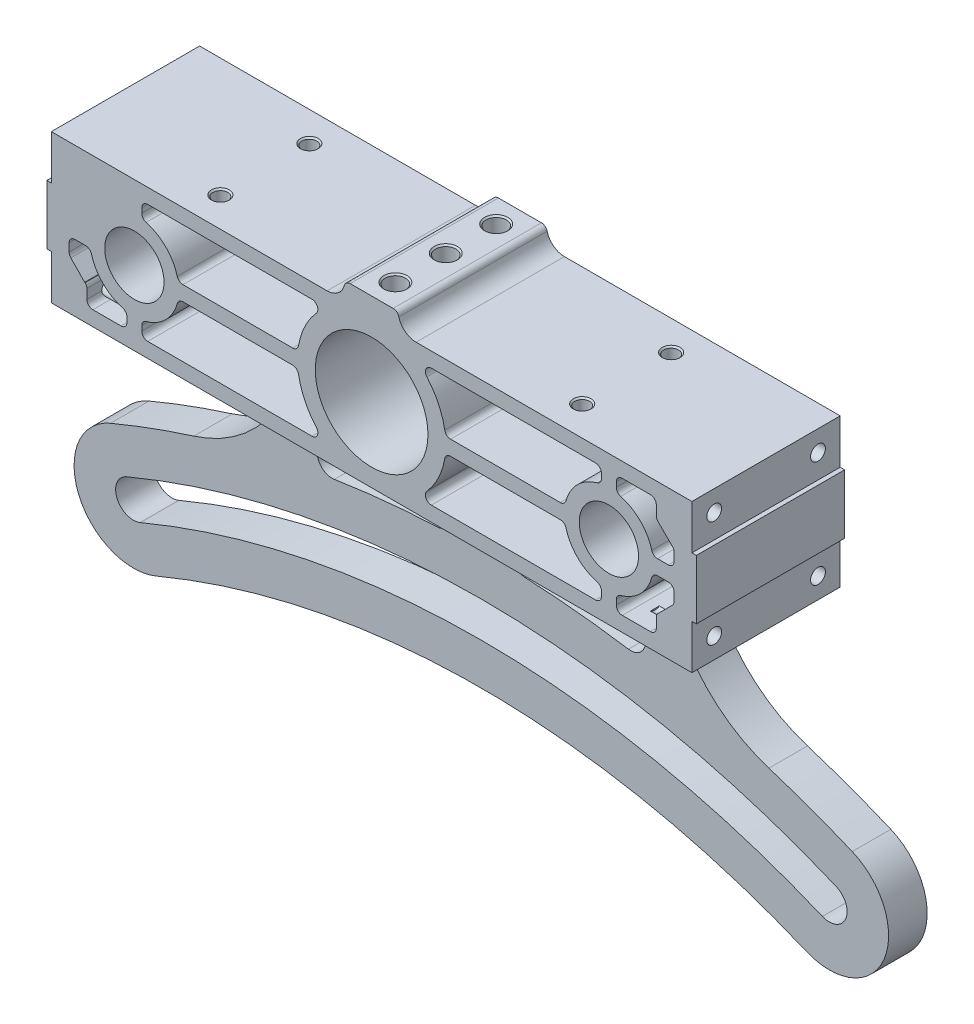
from build123d import *

# Parameters (mm, degrees)
SKETCH_1_R               = 5
SKETCH_1_R_2             = 10
SKETCH_1_R_3             = 19
EXTRUDE_1_DEPTH          = 50
CUT_EXTRUDE_2_DEPTH      = 500
SKETCH_3_R               = 2.5
CUT_EXTRUDE_3_DEPTH      = 20
SKETCH_4_R               = 2.5
CUT_EXTRUDE_4_DEPTH      = 20
CHAMFER_1_SIZE           = 0.5
CUT_EXTRUDE_5_REACH      = 1135.72
CUT_EXTRUDE_5_END_RADIUS = 19
SKETCH_5_R               = 3.425
CHAMFER_2_SIZE           = 0.5


with BuildPart() as part:
    # 草图1 → 拉伸1 (new body)
    with BuildSketch(Plane.XY):
        with BuildLine():
            Line((1092.414463445, 1251.175356322), (1093.914463445, 1251.175356322))
            Line((1093.914463445, 1251.175356322), (1093.914463445, 1271.175356322))
            Line((1093.914463445, 1271.175356322), (1092.414463445, 1271.175356322))
            Line((1092.414463445, 1271.175356322), (1092.414463445, 1286.175356322))
            Line((1092.414463445, 1286.175356322), (999.414463445, 1286.175356322))
            ThreePointArc((999.414463445, 1286.175356322), (995.74022883, 1287.431939832), (993.604988425, 1290.675356322))
            ThreePointArc((993.604988425, 1290.675356322), (992.893241624, 1291.756495152), (991.668496752, 1292.175356322))
            Line((991.668496752, 1292.175356322), (977.160430137, 1292.175356322))
            ThreePointArc((977.160430137, 1292.175356322), (975.935685266, 1291.756495152), (975.223938464, 1290.675356322))
            ThreePointArc((975.223938464, 1290.675356322), (973.088698059, 1287.431939832), (969.414463445, 1286.175356322))
            Line((969.414463445, 1286.175356322), (876.414463445, 1286.175356322))
            Line((876.414463445, 1286.175356322), (876.414463445, 1271.175356322))
            Line((876.414463445, 1271.175356322), (874.914463445, 1271.175356322))
            Line((874.914463445, 1271.175356322), (874.914463445, 1251.175356322))
            Line((874.914463445, 1251.175356322), (876.414463445, 1251.175356322))
            Line((876.414463445, 1251.175356322), (876.414463445, 1236.175356322))
            Line((876.414463445, 1236.175356322), (916.18140927, 1236.175356322))
            ThreePointArc((916.18140927, 1236.175356322), (924.94928431, 1230.98413655), (924.613966096, 1220.800229777))
            Line((924.613966096, 1220.800229777), (914.603278077, 1205.095353829))
            ThreePointArc((914.603278077, 1205.095353829), (902.862999443, 1192.291380213), (887.450409428, 1184.277145889))
            ThreePointArc((887.450409428, 1184.277145889), (873.281582738, 1179.454480881), (859.351378992, 1173.980618339))
            ThreePointArc((859.351378992, 1173.980618339), (848.655242851, 1147.796793721), (874.839067469, 1137.100657579))
            ThreePointArc((874.839067469, 1137.100657579), (984.414463445, 1159.174935205), (1093.98985942, 1137.100657579))
            ThreePointArc((1093.98985942, 1137.100657579), (1120.173684039, 1147.796793721), (1109.477547897, 1173.980618339))
            ThreePointArc((1109.477547897, 1173.980618339), (1095.547344151, 1179.454480881), (1081.378517461, 1184.277145889))
            ThreePointArc((1081.378517461, 1184.277145889), (1065.965927446, 1192.291380213), (1054.225648812, 1205.095353829))
            Line((1054.225648812, 1205.095353829), (1044.214960793, 1220.800229777))
            ThreePointArc((1044.214960793, 1220.800229777), (1043.879642579, 1230.98413655), (1052.64751762, 1236.175356322))
            Line((1052.64751762, 1236.175356322), (1092.414463445, 1236.175356322))
            Line((1092.414463445, 1236.175356322), (1092.414463445, 1251.175356322))
        make_face()
        with Locations((984.414463445, 1216.175356322)):
            Circle(SKETCH_1_R, mode=Mode.SUBTRACT)
        with Locations((904.414463445, 1261.175356322)):
            Circle(SKETCH_1_R_2, mode=Mode.SUBTRACT)
        with Locations((1064.414463445, 1261.175356322)):
            Circle(SKETCH_1_R_2, mode=Mode.SUBTRACT)
        with Locations((984.414463445, 1261.175356322)):
            Circle(SKETCH_1_R_3, mode=Mode.SUBTRACT)
        with BuildLine():
            Line((974.414463445, 1221.175356322), (974.414463445, 1203.831767882))
            ThreePointArc((974.414463445, 1203.831767882), (973.029936628, 1200.378023007), (969.643121981, 1198.836999091))
            ThreePointArc((969.643121981, 1198.836999091), (952.193462787, 1197.563807315), (934.838343201, 1195.347628745))
            ThreePointArc((934.838343201, 1195.347628745), (929.885049048, 1197.553686969), (929.854632586, 1202.975945787))
            Line((929.854632586, 1202.975945787), (943.168521797, 1223.862919594))
            ThreePointArc((943.168521797, 1223.862919594), (944.980410096, 1225.559293842), (947.38480021, 1226.175356322))
            Line((947.38480021, 1226.175356322), (969.414463445, 1226.175356322))
            ThreePointArc((969.414463445, 1226.175356322), (972.949997351, 1224.710890228), (974.414463445, 1221.175356322))
        make_face(mode=Mode.SUBTRACT)
        with BuildLine():
            Line((994.414463445, 1221.175356322), (994.414463445, 1203.831767882))
            ThreePointArc((994.414463445, 1203.831767882), (995.798990261, 1200.378023007), (999.185804908, 1198.836999091))
            ThreePointArc((999.185804908, 1198.836999091), (1016.635464102, 1197.563807315), (1033.990583688, 1195.347628745))
            ThreePointArc((1033.990583688, 1195.347628745), (1038.943877841, 1197.553686969), (1038.974294303, 1202.975945787))
            Line((1038.974294303, 1202.975945787), (1025.660405092, 1223.862919594))
            ThreePointArc((1025.660405092, 1223.862919594), (1023.848516793, 1225.559293842), (1021.444126679, 1226.175356322))
            Line((1021.444126679, 1226.175356322), (999.414463445, 1226.175356322))
            ThreePointArc((999.414463445, 1226.175356322), (995.878929539, 1224.710890228), (994.414463445, 1221.175356322))
        make_face(mode=Mode.SUBTRACT)
        with BuildLine():
            Line((883.000249882, 1252.589569884), (887.661517332, 1247.795218361))
            Line((887.661517332, 1247.795218361), (887.828677007, 1247.76114276))
            ThreePointArc((887.828677007, 1247.76114276), (888.26222251, 1247.112296062), (888.414463445, 1246.346929197))
            Line((888.414463445, 1246.346929197), (888.414463445, 1243.175356322))
            ThreePointArc((888.414463445, 1243.175356322), (889.000249882, 1241.76114276), (890.414463445, 1241.175356322))
            Line((890.414463445, 1241.175356322), (899.914463445, 1241.175356322))
            ThreePointArc((899.914463445, 1241.175356322), (901.328677007, 1241.76114276), (901.914463445, 1243.175356322))
            Line((901.914463445, 1243.175356322), (901.914463445, 1244.781760011))
            ThreePointArc((901.914463445, 1244.781760011), (901.504875896, 1245.994438136), (900.44387521, 1246.710418401))
            ThreePointArc((900.44387521, 1246.710418401), (893.807861727, 1250.568754604), (889.949525523, 1257.204768087))
            ThreePointArc((889.949525523, 1257.204768087), (889.233545259, 1258.265768773), (888.020867134, 1258.675356322))
            Line((888.020867134, 1258.675356322), (884.414463445, 1258.675356322))
            ThreePointArc((884.414463445, 1258.675356322), (883.000249882, 1258.089569884), (882.414463445, 1256.675356322))
            Line((882.414463445, 1256.675356322), (882.414463445, 1254.003783447))
            ThreePointArc((882.414463445, 1254.003783447), (882.56670438, 1253.238416582), (883.000249882, 1252.589569884))
        make_face(mode=Mode.SUBTRACT)
        with BuildLine():
            Line((920.808059756, 1258.675356322), (957.792104421, 1258.675356322))
            ThreePointArc((957.792104421, 1258.675356322), (959.08309887, 1258.202881554), (959.764131015, 1257.008689656))
            ThreePointArc((959.764131015, 1257.008689656), (961.887952614, 1250.333017562), (965.780563632, 1244.508689656))
            ThreePointArc((965.780563632, 1244.508689656), (966.115593506, 1242.358859741), (964.289851647, 1241.175356322))
            Line((964.289851647, 1241.175356322), (908.914463445, 1241.175356322))
            ThreePointArc((908.914463445, 1241.175356322), (907.500249883, 1241.76114276), (906.914463445, 1243.175356322))
            Line((906.914463445, 1243.175356322), (906.914463445, 1244.781760012))
            ThreePointArc((906.914463445, 1244.781760012), (907.324050994, 1245.994438137), (908.38505168, 1246.710418401))
            ThreePointArc((908.38505168, 1246.710418401), (915.021065163, 1250.568754605), (918.879401366, 1257.204768087))
            ThreePointArc((918.879401366, 1257.204768087), (919.595381631, 1258.265768774), (920.808059756, 1258.675356322))
        make_face(mode=Mode.SUBTRACT)
        with BuildLine():
            Line((920.808059756, 1263.675356322), (957.792104421, 1263.675356322))
            ThreePointArc((957.792104421, 1263.675356322), (959.08309887, 1264.147831091), (959.764131015, 1265.342022989))
            ThreePointArc((959.764131015, 1265.342022989), (961.887952614, 1272.017695083), (965.780563632, 1277.842022989))
            ThreePointArc((965.780563632, 1277.842022989), (966.115593506, 1279.991852903), (964.289851647, 1281.175356322))
            Line((964.289851647, 1281.175356322), (908.914463445, 1281.175356322))
            ThreePointArc((908.914463445, 1281.175356322), (907.500249883, 1280.589569885), (906.914463445, 1279.175356322))
            Line((906.914463445, 1279.175356322), (906.914463445, 1277.568952633))
            ThreePointArc((906.914463445, 1277.568952633), (907.324050994, 1276.356274508), (908.38505168, 1275.640294244))
            ThreePointArc((908.38505168, 1275.640294244), (915.021065163, 1271.78195804), (918.879401366, 1265.145944558))
            ThreePointArc((918.879401366, 1265.145944558), (919.595381631, 1264.084943871), (920.808059756, 1263.675356322))
        make_face(mode=Mode.SUBTRACT)
        with BuildLine():
            Line((1011.036822469, 1263.675356322), (1048.020867134, 1263.675356322))
            ThreePointArc((1048.020867134, 1263.675356322), (1049.233545259, 1264.084943871), (1049.949525524, 1265.145944558))
            ThreePointArc((1049.949525524, 1265.145944558), (1053.807861727, 1271.78195804), (1060.44387521, 1275.640294244))
            ThreePointArc((1060.44387521, 1275.640294244), (1061.504875896, 1276.356274508), (1061.914463445, 1277.568952633))
            Line((1061.914463445, 1277.568952633), (1061.914463445, 1279.175356322))
            ThreePointArc((1061.914463445, 1279.175356322), (1061.328677007, 1280.589569885), (1059.914463445, 1281.175356322))
            Line((1059.914463445, 1281.175356322), (1004.539075242, 1281.175356322))
            ThreePointArc((1004.539075242, 1281.175356322), (1002.713333384, 1279.991852903), (1003.048363257, 1277.842022989))
            ThreePointArc((1003.048363257, 1277.842022989), (1006.940974275, 1272.017695083), (1009.064795875, 1265.342022989))
            ThreePointArc((1009.064795875, 1265.342022989), (1009.74582802, 1264.147831091), (1011.036822469, 1263.675356322))
        make_face(mode=Mode.SUBTRACT)
        with BuildLine():
            Line((1011.036822469, 1258.675356322), (1048.020867134, 1258.675356322))
            ThreePointArc((1048.020867134, 1258.675356322), (1049.233545259, 1258.265768774), (1049.949525524, 1257.204768087))
            ThreePointArc((1049.949525524, 1257.204768087), (1053.807861727, 1250.568754605), (1060.44387521, 1246.710418401))
            ThreePointArc((1060.44387521, 1246.710418401), (1061.504875896, 1245.994438137), (1061.914463445, 1244.781760012))
            Line((1061.914463445, 1244.781760012), (1061.914463445, 1243.175356322))
            ThreePointArc((1061.914463445, 1243.175356322), (1061.328677007, 1241.76114276), (1059.914463445, 1241.175356322))
            Line((1059.914463445, 1241.175356322), (1004.539075242, 1241.175356322))
            ThreePointArc((1004.539075242, 1241.175356322), (1002.713333384, 1242.358859741), (1003.048363257, 1244.508689656))
            ThreePointArc((1003.048363257, 1244.508689656), (1006.940974275, 1250.333017562), (1009.064795875, 1257.008689656))
            ThreePointArc((1009.064795875, 1257.008689656), (1009.74582802, 1258.202881554), (1011.036822469, 1258.675356322))
        make_face(mode=Mode.SUBTRACT)
        with BuildLine():
            Line((1081.000249883, 1274.589569885), (1085.828677007, 1269.76114276))
            ThreePointArc((1085.828677007, 1269.76114276), (1086.26222251, 1269.112296062), (1086.414463445, 1268.346929198))
            Line((1086.414463445, 1268.346929198), (1086.414463445, 1265.675356322))
            ThreePointArc((1086.414463445, 1265.675356322), (1085.828677007, 1264.26114276), (1084.414463445, 1263.675356322))
            Line((1084.414463445, 1263.675356322), (1080.808059756, 1263.675356322))
            ThreePointArc((1080.808059756, 1263.675356322), (1079.595381631, 1264.084943871), (1078.879401366, 1265.145944558))
            ThreePointArc((1078.879401366, 1265.145944558), (1075.021065163, 1271.78195804), (1068.38505168, 1275.640294244))
            ThreePointArc((1068.38505168, 1275.640294244), (1067.324050994, 1276.356274508), (1066.914463445, 1277.568952633))
            Line((1066.914463445, 1277.568952633), (1066.914463445, 1279.175356322))
            ThreePointArc((1066.914463445, 1279.175356322), (1067.500249883, 1280.589569885), (1068.914463445, 1281.175356322))
            Line((1068.914463445, 1281.175356322), (1078.414463445, 1281.175356322))
            ThreePointArc((1078.414463445, 1281.175356322), (1079.828677007, 1280.589569885), (1080.414463445, 1279.175356323))
            Line((1080.414463445, 1279.175356323), (1080.414463445, 1276.003783447))
            ThreePointArc((1080.414463445, 1276.003783447), (1080.56670438, 1275.238416583), (1081.000249883, 1274.589569885))
        make_face(mode=Mode.SUBTRACT)
        with BuildLine():
            Line((1085.828677007, 1252.589569885), (1081.000249883, 1247.76114276))
            ThreePointArc((1081.000249883, 1247.76114276), (1080.56670438, 1247.112296062), (1080.414463445, 1246.346929198))
            Line((1080.414463445, 1246.346929198), (1080.414463445, 1243.175356322))
            ThreePointArc((1080.414463445, 1243.175356322), (1079.828677007, 1241.76114276), (1078.414463445, 1241.175356322))
            Line((1078.414463445, 1241.175356322), (1068.914463445, 1241.175356322))
            ThreePointArc((1068.914463445, 1241.175356322), (1067.500249883, 1241.76114276), (1066.914463445, 1243.175356322))
            Line((1066.914463445, 1243.175356322), (1066.914463445, 1244.781760012))
            ThreePointArc((1066.914463445, 1244.781760012), (1067.324050994, 1245.994438137), (1068.38505168, 1246.710418401))
            ThreePointArc((1068.38505168, 1246.710418401), (1075.021065163, 1250.568754605), (1078.879401366, 1257.204768087))
            ThreePointArc((1078.879401366, 1257.204768087), (1079.595381631, 1258.265768774), (1080.808059756, 1258.675356322))
            Line((1080.808059756, 1258.675356322), (1084.414463445, 1258.675356322))
            ThreePointArc((1084.414463445, 1258.675356322), (1085.828677007, 1258.089569885), (1086.414463445, 1256.675356322))
            Line((1086.414463445, 1256.675356322), (1086.414463445, 1254.003783447))
            ThreePointArc((1086.414463445, 1254.003783447), (1086.26222251, 1253.238416582), (1085.828677007, 1252.589569885))
        make_face(mode=Mode.SUBTRACT)
        with BuildLine():
            ThreePointArc((1099.410550387, 1150.008643845), (984.414463445, 1173.174935205), (869.418376502, 1150.008643845))
            ThreePointArc((869.418376502, 1150.008643845), (861.563229116, 1153.217484688), (864.772069959, 1161.072632073))
            ThreePointArc((864.772069959, 1161.072632073), (984.414463445, 1185.174935205), (1104.05685693, 1161.072632073))
            ThreePointArc((1104.05685693, 1161.072632073), (1107.265697773, 1153.217484688), (1099.410550387, 1150.008643845))
        make_face(mode=Mode.SUBTRACT)
    extrude(amount=-EXTRUDE_1_DEPTH)

    # 草图2 → 拉伸2 (cut, symmetric)
    with BuildSketch(Plane(origin=(1093.914463445, 0, 0), x_dir=(0, 0, -1), z_dir=(1, 0, 0))):
        with BuildLine():
            Line((-1.981460207, 1236.175356322), (27, 1236.175356322))
            ThreePointArc((27, 1236.175356322), (34.071067812, 1233.246424134), (37, 1226.175356322))
            Line((37, 1226.175356322), (37, 1128.183230419))
            Line((37, 1128.183230419), (-10.931449984, 1128.183230419))
            Line((-10.931449984, 1128.183230419), (-10.931449984, 1236.175356322))
            Line((-10.931449984, 1236.175356322), (-1.981460207, 1236.175356322))
        make_face()
    extrude(amount=CUT_EXTRUDE_2_DEPTH, both=True, mode=Mode.SUBTRACT)

    # 草图3 → 拉伸3 (cut)
    with BuildSketch(Plane(origin=(1092.414463445, 0, 0), x_dir=(0, 0, -1), z_dir=(1, 0, 0))):
        with Locations((7.5, 1243.175356322)):
            Circle(SKETCH_3_R)
        with Locations((42.5, 1243.175356322)):
            Circle(SKETCH_3_R)
        with Locations((42.5, 1279.175356322)):
            Circle(SKETCH_3_R)
        with Locations((7.5, 1279.175356322)):
            Circle(SKETCH_3_R)
    cut_extrude_3 = extrude(amount=-CUT_EXTRUDE_3_DEPTH, mode=Mode.SUBTRACT)

    # 镜向1: 拉伸3 across plane
    add(cut_extrude_3.mirror(Plane(origin=(984.414463445, 0, 0), x_dir=(0, 0, 1), z_dir=(1, 0, 0))), mode=Mode.SUBTRACT)

    # 草图4 → 拉伸4 (cut)
    with BuildSketch(Plane(origin=(0, 1286.175356322, 0), x_dir=(1, 0, 0), z_dir=(0, 1, 0))):
        with Locations(Location((923.414463445, 40, 0), (0, 0, 270))):
            Circle(SKETCH_4_R)
        with Locations(Location((923.414463445, 10, 0), (0, 0, 270))):
            Circle(SKETCH_4_R)
        with Locations(Location((1045.414463445, 40, 0), (0, 0, 270))):
            Circle(SKETCH_4_R)
        with Locations(Location((1045.414463445, 10, 0), (0, 0, 270))):
            Circle(SKETCH_4_R)
    extrude(amount=-CUT_EXTRUDE_4_DEPTH, mode=Mode.SUBTRACT)

    # 倒角1
    chamfer_1_edges = [part.edges().sort_by_distance(p)[0] for p in [
        (923.414463445, 1286.175356322, -42.5),
        (923.414463445, 1286.175356322, -12.5),
        (1045.414463445, 1286.175356322, -42.5),
        (1045.414463445, 1286.175356322, -12.5),
    ]]
    chamfer(chamfer_1_edges, length=CHAMFER_1_SIZE)

    # 拉伸5: up to this cylinder (the profile starts outside it)
    cut_extrude_5_end = Plane(origin=(984.414463445, 1261.175356322, -25), z_dir=(0, 0, 1)) * Cylinder(CUT_EXTRUDE_5_END_RADIUS, 2344.439999999, mode=Mode.PRIVATE)
    # 草图5 → 拉伸5 (cut, up to the surface)
    with BuildSketch(Plane(origin=(0, 1292.175356322, 0), x_dir=(1, 0, 0), z_dir=(0, 1, 0)), mode=Mode.PRIVATE) as cut_extrude_5_sk1:
        with Locations(Location((984.414463445, 42, 0), (0, 0, 270))):
            Circle(SKETCH_5_R)
    cut_extrude_5_tool1 = extrude(cut_extrude_5_sk1.sketch, amount=-CUT_EXTRUDE_5_REACH, mode=Mode.PRIVATE) - cut_extrude_5_end
    add(cut_extrude_5_tool1.solids().sort_by_distance((984.414463, 1292.175356, -42))[0], mode=Mode.SUBTRACT)
    # 草图5 → 拉伸5 (cut, up to the surface)
    with BuildSketch(Plane(origin=(0, 1292.175356322, 0), x_dir=(1, 0, 0), z_dir=(0, 1, 0)), mode=Mode.PRIVATE) as cut_extrude_5_sk2:
        with Locations(Location((984.414463445, 25, 0), (0, 0, 270))):
            Circle(SKETCH_5_R)
    cut_extrude_5_tool2 = extrude(cut_extrude_5_sk2.sketch, amount=-CUT_EXTRUDE_5_REACH, mode=Mode.PRIVATE) - cut_extrude_5_end
    add(cut_extrude_5_tool2.solids().sort_by_distance((984.414463, 1292.175356, -25))[0], mode=Mode.SUBTRACT)
    # 草图5 → 拉伸5 (cut, up to the surface)
    with BuildSketch(Plane(origin=(0, 1292.175356322, 0), x_dir=(1, 0, 0), z_dir=(0, 1, 0)), mode=Mode.PRIVATE) as cut_extrude_5_sk3:
        with Locations(Location((984.414463445, 8, 0), (0, 0, 270))):
            Circle(SKETCH_5_R)
    cut_extrude_5_tool3 = extrude(cut_extrude_5_sk3.sketch, amount=-CUT_EXTRUDE_5_REACH, mode=Mode.PRIVATE) - cut_extrude_5_end
    add(cut_extrude_5_tool3.solids().sort_by_distance((984.414463, 1292.175356, -8))[0], mode=Mode.SUBTRACT)

    # 倒角2
    chamfer_2_edges = [part.edges().sort_by_distance(p)[0] for p in [
        (984.414463445, 1292.175356322, -45.425),
        (984.414463445, 1292.175356322, -28.425),
        (984.414463445, 1292.175356322, -11.425),
    ]]
    chamfer(chamfer_2_edges, length=CHAMFER_2_SIZE)


solid = part.part
